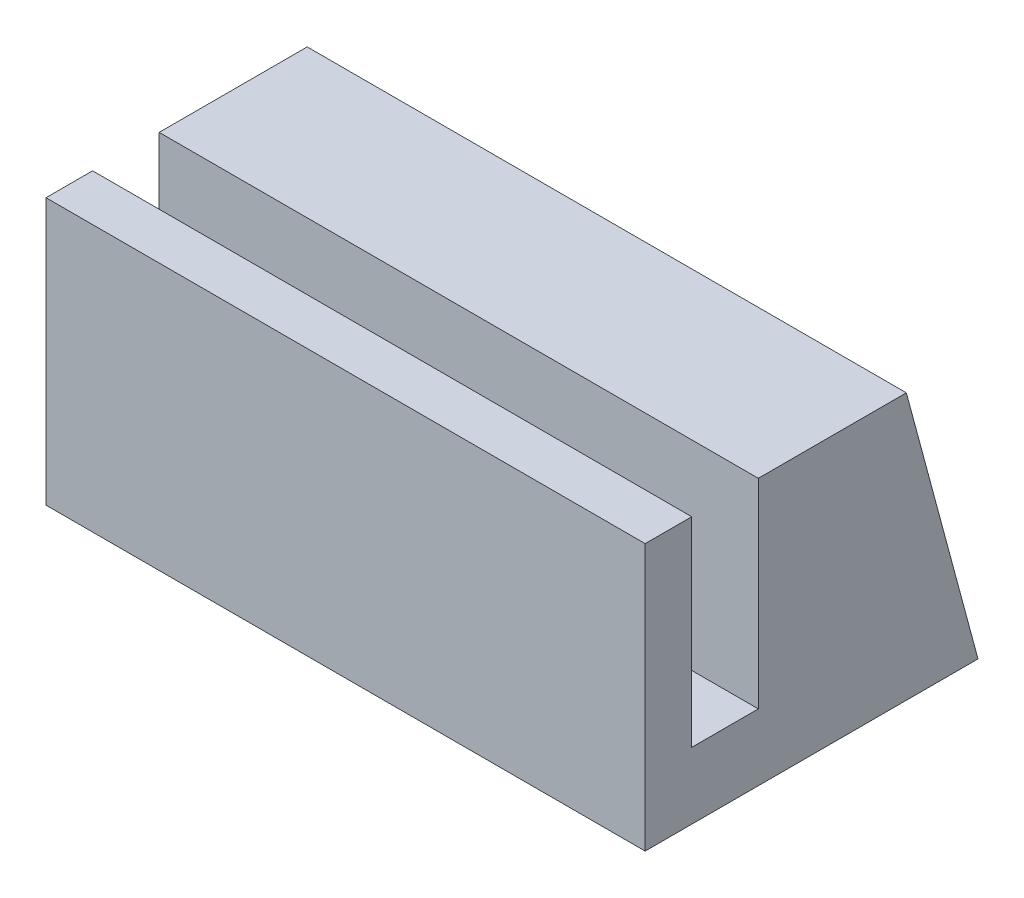
from build123d import *

# Parameters (mm, degrees)
SKETCH2_W           = 45
SKETCH2_H           = 20
BOSS_EXTRUDE1_DEPTH = 25
SKETCH5_W           = 45
SKETCH5_H           = 5
CUT_EXTRUDE1_DEPTH  = 15
CUT_EXTRUDE2_DEPTH  = 45
SKETCH8_W           = 38.3
SKETCH8_H           = 9.6
CUT_EXTRUDE3_DEPTH  = 10


with BuildPart() as part:
    # Sketch2 → Boss-Extrude1 (new body)
    with BuildSketch(Plane.XY):
        Rectangle(SKETCH2_W, SKETCH2_H)
    extrude(amount=BOSS_EXTRUDE1_DEPTH)

    # Sketch5 → Cut-Extrude1 (cut)
    with BuildSketch(Plane(origin=(0, 10, 0), x_dir=(1, 0, 0), z_dir=(0, 1, 0))):
        with Locations((0, -19)):
            Rectangle(SKETCH5_W, SKETCH5_H)
    extrude(amount=-CUT_EXTRUDE1_DEPTH, mode=Mode.SUBTRACT)

    # Sketch7 → Cut-Extrude2 (cut)
    with BuildSketch(Plane(origin=(22.5, 0, 0), x_dir=(0, 0, -1), z_dir=(1, 0, 0))):
        Polygon((0, -10), (0, 10), (-5.381576505, 10), align=None)
    extrude(amount=-CUT_EXTRUDE2_DEPTH, mode=Mode.SUBTRACT)

    # Sketch8 → Cut-Extrude3 (cut)
    with BuildSketch(Plane(origin=(0, -0.675150911, 2.509119438), x_dir=(-1, 0, 0), z_dir=(0, 0.25983666232132585, -0.9656525818914965))):
        Rectangle(SKETCH8_W, SKETCH8_H)
    extrude(amount=-CUT_EXTRUDE3_DEPTH, mode=Mode.SUBTRACT)


solid = part.part
